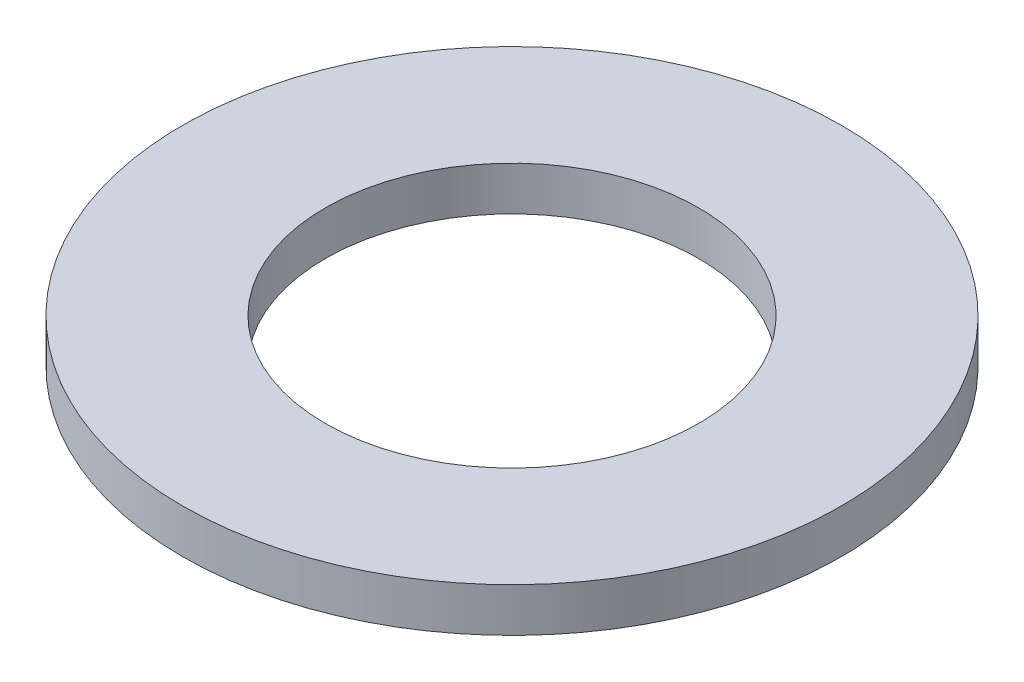
from build123d import *

# Parameters (mm, degrees)
SKETCH1_R           = 7.5
SKETCH1_R_2         = 4.25
BOSS_EXTRUDE1_DEPTH = 1


with BuildPart() as part:
    # Sketch1 → Boss-Extrude1 (new body)
    with BuildSketch(Plane(origin=(0, 0, 0), x_dir=(1, 0, 0), z_dir=(0, 1, 0))):
        with Locations(Location((0, 0, 0), (0, 0, 270))):
            Circle(SKETCH1_R)
        with Locations(Location((0, 0, 0), (0, 0, 270))):
            Circle(SKETCH1_R_2, mode=Mode.SUBTRACT)
    extrude(amount=BOSS_EXTRUDE1_DEPTH)


solid = part.part
